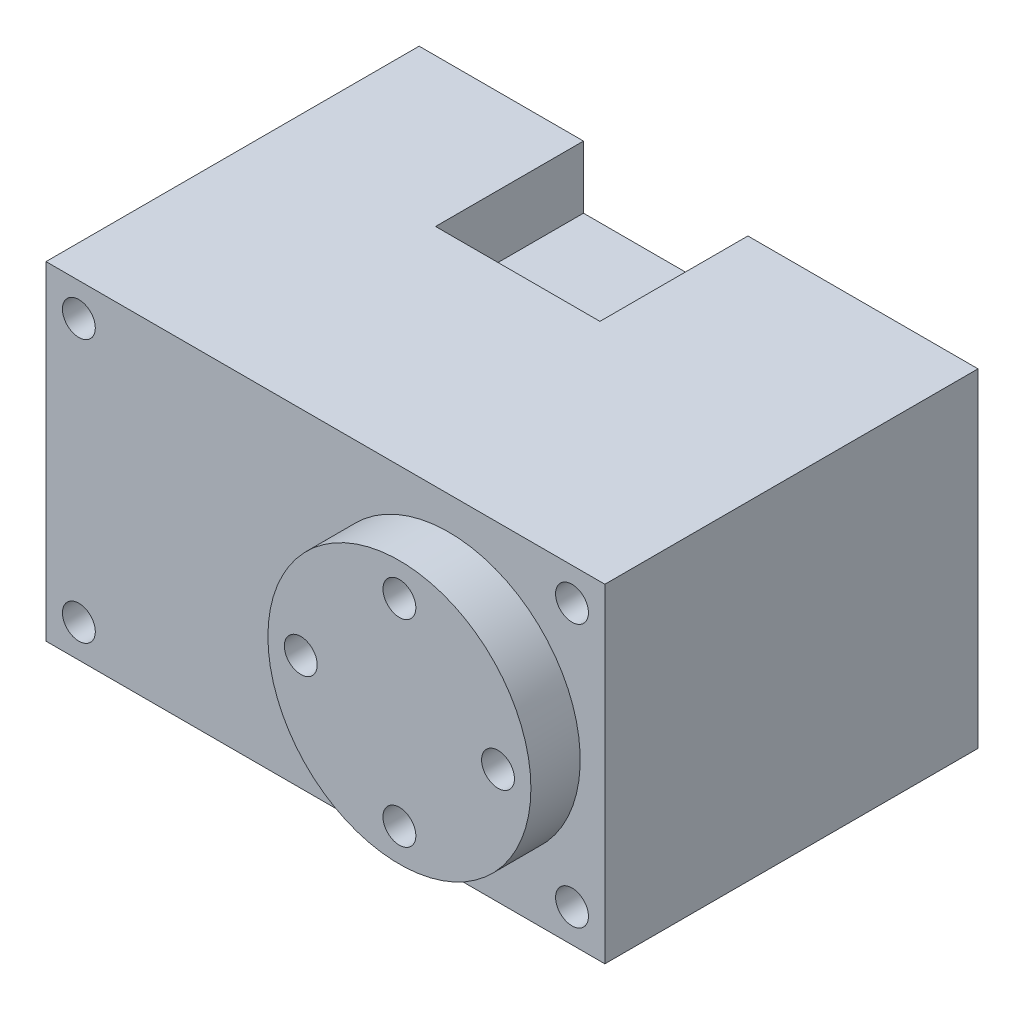
from build123d import *

# Parameters (mm, degrees)
SKETCH_1_W               = 34
SKETCH_1_H               = 20
EXTRUDE_1_DEPTH          = 22.7
SKETCH_2_R               = 8
EXTRUDE_2_DEPTH          = 3
SKETCH_3_R               = 1
CUT_EXTRUDE_1_DEPTH      = 6
CUT_EXTRUDE_START        = -6
SKETCH_5_R               = 1
CUT_EXTRUDE_2_DEPTH      = 6
SKETCH_6_R               = 5
CUT_EXTRUDE_3_DEPTH      = 1
SKETCH_7_R               = 2.5
CUT_EXTRUDE_4_DEPTH      = 2
SKETCH_8_W               = 10
SKETCH_8_H               = 9
CUT_EXTRUDE_5_DEPTH      = 3.8
SKETCH_9_R               = 1.25
CUT_EXTRUDE_6_DEPTH      = 3.8
SKETCH_10_R              = 1
CUT_EXTRUDE_7_DEPTH      = 6
PATTERN_CIRCULAR_1_COUNT = 4


with BuildPart() as part:
    # 草图1 → 凸台-拉伸1 (new body)
    with BuildSketch(Plane.XY):
        Rectangle(SKETCH_1_W, SKETCH_1_H)
    extrude(amount=EXTRUDE_1_DEPTH)

    # 草图2 → 凸台-拉伸2 (add)
    with BuildSketch(Plane.XY.offset(22.7)):
        with Locations(Location((7.5, 0, 0), (0, 0, 180))):
            Circle(SKETCH_2_R)
    extrude(amount=EXTRUDE_2_DEPTH)

    # 草图3 → 切除-拉伸1 (cut)
    with BuildSketch(Plane.XY.offset(22.7)):
        with Locations((-15, 8)):
            Circle(SKETCH_3_R)
        with Locations((15, 8)):
            Circle(SKETCH_3_R)
        with Locations((-15, -8)):
            Circle(SKETCH_3_R)
        with Locations((15, -8)):
            Circle(SKETCH_3_R)
    extrude(amount=-CUT_EXTRUDE_1_DEPTH, mode=Mode.SUBTRACT)

    # 草图5 → 切除-拉伸2 (cut)
    with BuildSketch(Plane(origin=(0, 0, 0), x_dir=(-1, 0, 0), z_dir=(0, 0, -1)).offset(CUT_EXTRUDE_START)):
        with Locations(Location((-15, 8, 0), (0, 0, 180))):
            Circle(SKETCH_5_R)
        with Locations(Location((15, 8, 0), (0, 0, 180))):
            Circle(SKETCH_5_R)
        with Locations(Location((-15, -8, 0), (0, 0, 180))):
            Circle(SKETCH_5_R)
        with Locations(Location((15, -8, 0), (0, 0, 180))):
            Circle(SKETCH_5_R)
    extrude(amount=CUT_EXTRUDE_2_DEPTH, mode=Mode.SUBTRACT)

    # 草图6 → 切除-拉伸3 (cut)
    with BuildSketch(Plane(origin=(0, 0, 0), x_dir=(-1, 0, 0), z_dir=(0, 0, -1))):
        with Locations((-7.5, 0)):
            Circle(SKETCH_6_R)
    extrude(amount=-CUT_EXTRUDE_3_DEPTH, mode=Mode.SUBTRACT)

    # 草图7 → 切除-拉伸4 (cut)
    with BuildSketch(Plane(origin=(0, 0, 1), x_dir=(-1, 0, 0), z_dir=(0, 0, -1))):
        with Locations((-7.5, 0)):
            Circle(SKETCH_7_R)
    extrude(amount=-CUT_EXTRUDE_4_DEPTH, mode=Mode.SUBTRACT)

    # 草图8 → 切除-拉伸5 (cut)
    with BuildSketch(Plane(origin=(0, 10, 0), x_dir=(1, 0, 0), z_dir=(0, 1, 0))):
        with Locations((-2, -4.5)):
            Rectangle(SKETCH_8_W, SKETCH_8_H)
    cut_extrude_5 = extrude(amount=-CUT_EXTRUDE_5_DEPTH, mode=Mode.SUBTRACT)

    # 镜向1: 切除-拉伸5 across plane
    add(cut_extrude_5.mirror(Plane.ZX), mode=Mode.SUBTRACT)

    # 草图9 → 切除-拉伸6 (cut)
    with BuildSketch(Plane(origin=(0, 0, 3), x_dir=(-1, 0, 0), z_dir=(0, 0, -1))):
        with Locations((-7.5, 0)):
            Circle(SKETCH_9_R)
    extrude(amount=-CUT_EXTRUDE_6_DEPTH, mode=Mode.SUBTRACT)

    # 草图10 → 切除-拉伸7 (cut)
    with BuildSketch(Plane.XY.offset(25.7)):
        with Locations((13.5, 0)):
            Circle(SKETCH_10_R)
    cut_extrude_7 = extrude(amount=-CUT_EXTRUDE_7_DEPTH, mode=Mode.SUBTRACT)

    # 阵列(圆周)1: 切除-拉伸7 ×4 about axis
    pattern_circular_1_axis = Axis((7.5, 0, 0), (0, 0, 1))
    for i in range(1, PATTERN_CIRCULAR_1_COUNT):
        add(cut_extrude_7.rotate(pattern_circular_1_axis, i * 360 / PATTERN_CIRCULAR_1_COUNT), mode=Mode.SUBTRACT)


solid = part.part
